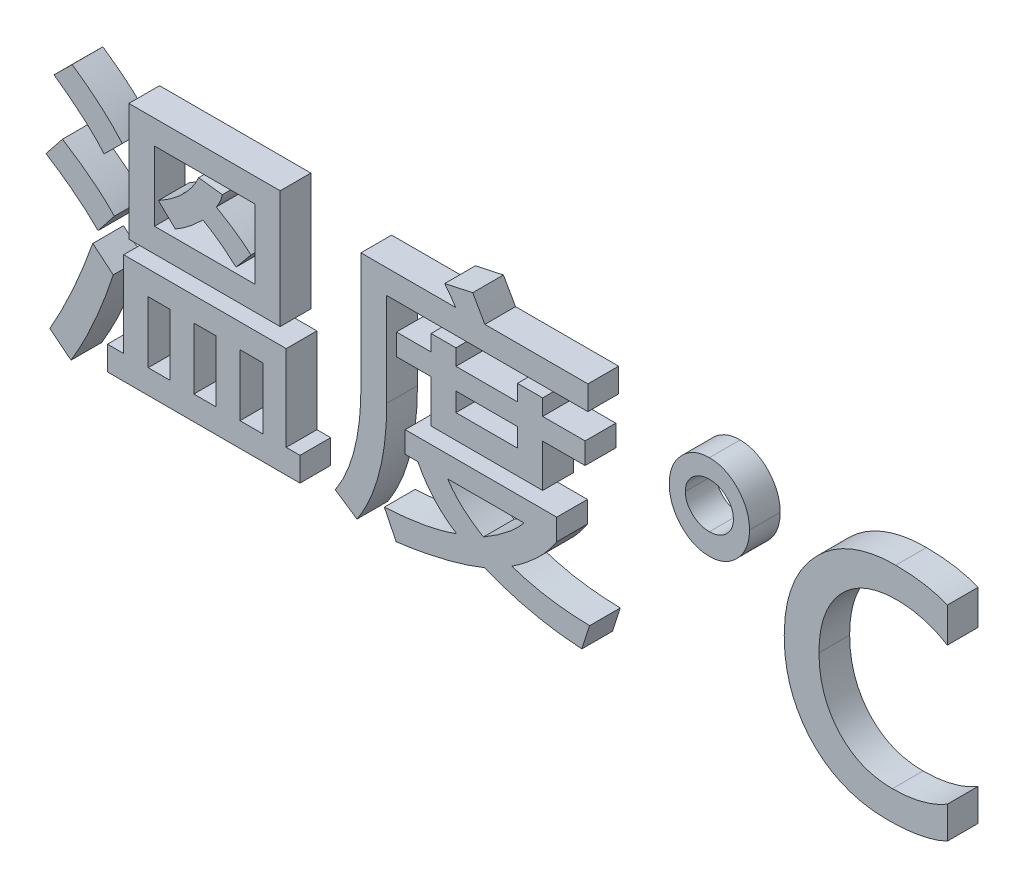
from build123d import *

# Parameters (mm, degrees)
EXTRUDE_1_DEPTH   = 3.5
SKETCH_1_W        = 17.254192073
SKETCH_1_H        = 13.414634147
SKETCH_1_W_2      = 11.43292683
SKETCH_1_H_2      = 7.926829269
EXTRUDE_1_2_DEPTH = 3.5
EXTRUDE_1_3_DEPTH = 3.5
EXTRUDE_1_4_DEPTH = 3.5
SKETCH_1_W_3      = 2.600990854
SKETCH_1_H_3      = 7.012195122
SKETCH_1_W_4      = 2.524771341
SKETCH_1_W_5      = 2.505716463
EXTRUDE_1_5_DEPTH = 3.5
EXTRUDE_1_6_DEPTH = 3.5
EXTRUDE_1_7_DEPTH = 3.5
SKETCH_1_W_6      = 7.012195122
SKETCH_1_H_4      = 2.134146342
EXTRUDE_1_8_DEPTH = 3.5
EXTRUDE_1_9_DEPTH = 3.5
EXTRUDE_2_DEPTH   = 3.5
EXTRUDE_2_2_DEPTH = 3.5


with BuildPart() as part:
    # 草圖1 → 填料-伸長1 (new body)
    with BuildSketch(Plane.XY):
        with BuildLine():
            Line((-55.558712661, 30.843381233), (-57.635694368, 28.785454404))
            add(Edge.make_bspline(
                [(-57.635694368, 28.785454404), (-57.800401407, 28.979405841), (-58.140346552, 29.379709617), (-58.707226202, 29.964119725), (-59.331666853, 30.562892377), (-60.012527692, 31.178815534), (-60.758403849, 31.802001544), (-61.564126763, 32.440019125), (-62.429207191, 33.092119277), (-63.03346811, 33.520531274), (-63.342630344, 33.739722697)],
                knots=[0, 0, 0, 0, 0.80563928, 1.662789676, 2.5768226, 3.545301035, 4.569701786, 5.654296259, 6.799851211, 8, 8, 8, 8], degree=3))
            Line((-63.342630344, 33.739722697), (-61.270412356, 35.797649526))
            add(Edge.make_bspline(
                [(-61.270412356, 35.797649526), (-60.981332808, 35.599898292), (-60.412267838, 35.210616861), (-59.600196193, 34.59556599), (-58.819410619, 33.987584256), (-58.084668757, 33.370087791), (-57.389056307, 32.748650238), (-56.73983428, 32.120449936), (-56.124311117, 31.492933354), (-55.745626313, 31.058039102), (-55.558712661, 30.843381233)],
                knots=[0, 0, 0, 0, 1.10839947, 2.181929898, 3.223550763, 4.240284569, 5.219043447, 6.175191646, 7.099299496, 8, 8, 8, 8], degree=3))
        make_face()
    extrude(amount=EXTRUDE_1_DEPTH)


with BuildPart() as body_2:
    # 草圖1 → Extrude 1 2 (new body)
    with BuildSketch(Plane.XY):
        with Locations((-46.178948942, 28.480576355)):
            Rectangle(SKETCH_1_W, SKETCH_1_H)
        with Locations((-46.164657783, 28.480576356)):
            Rectangle(SKETCH_1_W_2, SKETCH_1_H_2, mode=Mode.SUBTRACT)
    extrude(amount=EXTRUDE_1_2_DEPTH)


with BuildPart() as body_3:
    # 草圖1 → Extrude 1 3 (new body)
    with BuildSketch(Plane.XY):
        with BuildLine():
            Line((-40.881692844, 27.184844648), (-42.587104429, 25.126917819))
            add(Edge.make_bspline(
                [(-42.587104429, 25.126917819), (-42.886141398, 25.392072572), (-43.478048223, 25.916913728), (-44.407057172, 26.644063128), (-45.362003863, 27.306766094), (-46.022667983, 27.702879224), (-46.350442844, 27.899402575)],
                knots=[0, 0, 0, 0, 1.023875124, 2.026634626, 3.020955517, 4, 4, 4, 4], degree=3))
            add(Edge.make_bspline(
                [(-46.350442844, 27.899402575), (-46.620370409, 27.640189006), (-47.139239979, 27.141914466), (-47.943193422, 26.476416207), (-48.720643246, 25.899186155), (-49.256729825, 25.583183249), (-49.5135526, 25.431795868)],
                knots=[0, 0, 0, 0, 1.11587252, 2.144991361, 3.111321783, 4, 4, 4, 4], degree=3))
            Line((-49.5135526, 25.431795868), (-51.442859003, 27.280119038))
            add(Edge.make_bspline(
                [(-51.442859003, 27.280119038), (-51.170845347, 27.435521731), (-50.639486515, 27.739089555), (-49.89432728, 28.241597094), (-49.21447404, 28.768178654), (-48.60889461, 29.330274035), (-48.060170827, 29.908822306), (-47.588626488, 30.524871496), (-47.172380132, 31.159889043), (-46.95398156, 31.610950156), (-46.845869673, 31.834234892)],
                knots=[0, 0, 0, 0, 1.141474461, 2.229787087, 3.272903633, 4.272283632, 5.238641047, 6.175162408, 7.096667017, 8, 8, 8, 8], degree=3))
            Line((-46.845869673, 31.834234892), (-44.14484071, 31.505538246))
            add(Edge.make_bspline(
                [(-44.14484071, 31.505538246), (-44.177102639, 31.374525439), (-44.242676887, 31.108234283), (-44.393799642, 30.715737216), (-44.589031032, 30.322574118), (-44.751986806, 30.071721103), (-44.835580039, 29.943038246)],
                knots=[0, 0, 0, 0, 0.941217816, 1.913080006, 2.929449471, 4, 4, 4, 4], degree=3))
            add(Edge.make_bspline(
                [(-44.835580039, 29.943038246), (-44.439729411, 29.708138377), (-43.682121851, 29.258570021), (-42.627660951, 28.561874327), (-41.696462385, 27.886374621), (-41.144018235, 27.410711123), (-40.881692844, 27.184844648)],
                knots=[0, 0, 0, 0, 1.143743812, 2.188979619, 3.14004587, 4, 4, 4, 4], degree=3))
        make_face()
    extrude(amount=EXTRUDE_1_3_DEPTH)


with BuildPart() as body_4:
    # 草圖1 → Extrude 1 4 (new body)
    with BuildSketch(Plane.XY):
        with BuildLine():
            Line((-56.459055649, 23.221430014), (-58.326433698, 20.858625136))
            add(Edge.make_bspline(
                [(-58.326433698, 20.858625136), (-58.522404588, 21.053294227), (-58.921635802, 21.44987342), (-59.549459623, 22.037985731), (-60.228287017, 22.617044941), (-60.947839754, 23.198468583), (-61.711234875, 23.780840582), (-62.519219319, 24.359195308), (-63.37096237, 24.938413686), (-63.957874669, 25.315605878), (-64.25726449, 25.50801538)],
                knots=[0, 0, 0, 0, 0.877715064, 1.788078067, 2.73268409, 3.712181632, 4.727403113, 5.783191323, 6.86918377, 8, 8, 8, 8], degree=3))
            Line((-64.25726449, 25.50801538), (-62.375595283, 27.870820258))
            add(Edge.make_bspline(
                [(-62.375595283, 27.870820258), (-62.069664681, 27.677122218), (-61.46901202, 27.296822757), (-60.604409144, 26.710651564), (-59.787314225, 26.130701987), (-59.024132743, 25.547933711), (-58.308427615, 24.96736585), (-57.643171216, 24.386985888), (-57.024318814, 23.812365803), (-56.644602089, 23.415403439), (-56.459055649, 23.221430014)],
                knots=[0, 0, 0, 0, 1.15170325, 2.261210932, 3.322199032, 4.338470802, 5.315058025, 6.253002159, 7.14633934, 8, 8, 8, 8], degree=3))
        make_face()
    extrude(amount=EXTRUDE_1_4_DEPTH)


with BuildPart() as body_5:
    # 草圖1 → Extrude 1 5 (new body)
    with BuildSketch(Plane.XY):
        Polygon((-35.289086137, 7.44399099), (-57.249833088, 7.44399099), (-57.249833088, 10.187893429), (-55.401509917, 10.187893429), (-55.401509917, 19.94399099), (-36.861113576, 19.94399099), (-36.861113576, 10.187893429), (-35.289086137, 10.187893429), align=None)
        with Locations((-40.834055649, 13.69399099)):
            Rectangle(SKETCH_1_W_3, SKETCH_1_H_3, mode=Mode.SUBTRACT)
        with Locations((-46.131311747, 13.69399099)):
            Rectangle(SKETCH_1_W_4, SKETCH_1_H_3, mode=Mode.SUBTRACT)
        with Locations((-51.347584613, 13.69399099)):
            Rectangle(SKETCH_1_W_5, SKETCH_1_H_3, mode=Mode.SUBTRACT)
    extrude(amount=EXTRUDE_1_5_DEPTH)


with BuildPart() as body_6:
    # 草圖1 → Extrude 1 6 (new body)
    with BuildSketch(Plane.XY):
        with BuildLine():
            add(Edge.make_bspline(
                [(-56.587676076, 17.362055014), (-56.751881638, 16.865765667), (-57.077517627, 15.881574446), (-57.606425583, 14.432128536), (-58.170573979, 13.023598804), (-58.754585866, 11.64958402), (-59.371378855, 10.314589212), (-60.01073681, 9.013864504), (-60.689793187, 7.755281855), (-61.163599167, 6.9363053), (-61.399032783, 6.529356843)],
                knots=[0, 0, 0, 0, 1.056242446, 2.094634002, 3.117054769, 4.121869083, 5.111029164, 6.088215548, 7.050036625, 8, 8, 8, 8], degree=3))
            Line((-61.399032783, 6.529356843), (-63.823766015, 8.444372087))
            add(Edge.make_bspline(
                [(-63.823766015, 8.444372087), (-63.596473354, 8.84828589), (-63.136837406, 9.665088788), (-62.474020867, 10.921379806), (-61.840824029, 12.223190319), (-61.211357462, 13.55661105), (-60.614372181, 14.936631685), (-60.028144521, 16.354119542), (-59.460290978, 17.811861766), (-59.102455596, 18.801524021), (-58.921898637, 19.300888855)],
                knots=[0, 0, 0, 0, 0.932552104, 1.885826268, 2.857492246, 3.845184593, 4.852505817, 5.882555274, 6.931577484, 8, 8, 8, 8], degree=3))
            Line((-58.921898637, 19.300888855), (-56.587676076, 17.362055014))
        make_face()
    extrude(amount=EXTRUDE_1_6_DEPTH)


with BuildPart() as body_7:
    # 草圖1 → Extrude 1 7 (new body)
    with BuildSketch(Plane.XY):
        with BuildLine():
            Line((-2.457531259, 30.919600746), (-25.399604429, 30.919600746))
            Line((-25.399604429, 30.919600746), (-25.399604429, 20.267923916))
            add(Edge.make_bspline(
                [(-25.399604429, 20.267923916), (-25.409371988, 19.618159484), (-25.428507046, 18.345243518), (-25.586875948, 16.48015672), (-25.852760876, 14.702757044), (-26.222169664, 13.013130174), (-26.698896056, 11.410771016), (-27.279624891, 9.896155485), (-27.967373389, 8.46668903), (-28.518210157, 7.579215347), (-28.791372722, 7.139112941)],
                knots=[0, 0, 0, 0, 1.13379834, 2.221158835, 3.263630851, 4.268138338, 5.236941435, 6.178197068, 7.096559291, 8, 8, 8, 8], degree=3))
            Line((-28.791372722, 7.139112941), (-31.268506868, 8.796887331))
            add(Edge.make_bspline(
                [(-31.268506868, 8.796887331), (-31.032661934, 9.175511388), (-30.555223573, 9.941988096), (-29.963331443, 11.183936911), (-29.465713884, 12.508481561), (-29.047359622, 13.914604376), (-28.733478544, 15.408038624), (-28.504029779, 16.986133497), (-28.37226113, 18.649183657), (-28.353283876, 19.786558852), (-28.343583088, 20.367962026)],
                knots=[0, 0, 0, 0, 0.883888601, 1.789321126, 2.72197617, 3.687277845, 4.695045742, 5.744945383, 6.847261732, 8, 8, 8, 8], degree=3))
            Line((-28.343583088, 20.367962026), (-28.343583088, 33.663503185))
            Line((-28.343583088, 33.663503185), (-17.539467234, 33.663503185))
            add(Edge.make_bspline(
                [(-17.539467234, 33.663503185), (-17.74521127, 33.981839215), (-18.134187437, 34.583679889), (-18.581576978, 35.143373696), (-18.792325466, 35.407024526)],
                knots=[0, 0, 0, 0, 1.057874767, 2, 2, 2, 2], degree=3))
            Line((-18.792325466, 35.407024526), (-15.591105954, 36.102527575))
            add(Edge.make_bspline(
                [(-15.591105954, 36.102527575), (-15.367809832, 35.715638988), (-14.900729689, 34.906363954), (-14.446634208, 34.08973032), (-14.209627295, 33.663503185)],
                knots=[0, 0, 0, 0, 0.956136221, 2, 2, 2, 2], degree=3))
            Line((-14.209627295, 33.663503185), (-2.457531259, 33.663503185))
            Line((-2.457531259, 33.663503185), (-2.457531259, 30.919600746))
        make_face()
    extrude(amount=EXTRUDE_1_7_DEPTH)


with BuildPart() as body_8:
    # 草圖1 → Extrude 1 8 (new body)
    with BuildSketch(Plane.XY):
        Polygon((-2.776700466, 25.431795868), (-7.61663949, 25.431795868), (-7.61663949, 20.553747087), (-20.335770588, 20.553747087), (-20.335770588, 25.431795868), (-24.289657783, 25.431795868), (-24.289657783, 27.870820258), (-20.335770588, 27.870820258), (-20.335770588, 29.700088551), (-17.506121198, 29.700088551), (-17.506121198, 27.870820258), (-10.493926076, 27.870820258), (-10.493926076, 29.700088551), (-7.61663949, 29.700088551), (-7.61663949, 27.870820258), (-2.776700466, 27.870820258), align=None)
        with Locations((-14.000023637, 24.364722697)):
            Rectangle(SKETCH_1_W_6, SKETCH_1_H_4, mode=Mode.SUBTRACT)
    extrude(amount=EXTRUDE_1_8_DEPTH)


with BuildPart() as body_9:
    # 草圖1 → Extrude 1 9 (new body)
    with BuildSketch(Plane.XY):
        with BuildLine():
            Line((-2.262218759, 9.88301538), (-3.148270588, 7.139112941))
            add(Edge.make_bspline(
                [(-3.148270588, 7.139112941), (-3.636090584, 7.173477064), (-4.607101783, 7.241879239), (-6.050126155, 7.410382814), (-7.473377889, 7.631694093), (-8.871540974, 7.922332758), (-10.251886796, 8.250712066), (-11.604979596, 8.649194173), (-12.936982915, 9.100424313), (-13.807647369, 9.444307812), (-14.242973332, 9.616247087)],
                knots=[0, 0, 0, 0, 1.027575639, 2.045400889, 3.052110208, 4.053401572, 5.045672083, 6.033015074, 7.01652169, 8, 8, 8, 8], degree=3))
            add(Edge.make_bspline(
                [(-14.242973332, 9.616247087), (-14.605487198, 9.473497288), (-15.339498833, 9.18446003), (-16.480148143, 8.800097081), (-17.666838781, 8.443631053), (-18.905128695, 8.120337593), (-20.188441425, 7.824955848), (-21.523372323, 7.563978937), (-22.904944836, 7.329026465), (-23.8462099, 7.202967558), (-24.32300382, 7.139112941)],
                knots=[0, 0, 0, 0, 0.898245895, 1.818752324, 2.774414431, 3.754865284, 4.769181396, 5.810381228, 6.890857679, 8, 8, 8, 8], degree=3))
            Line((-24.32300382, 7.139112941), (-25.671136442, 9.88301538))
            add(Edge.make_bspline(
                [(-25.671136442, 9.88301538), (-25.261242882, 9.907192959), (-24.459514693, 9.954482912), (-23.287387264, 10.071243274), (-22.171921606, 10.212448729), (-21.113744691, 10.383920442), (-20.111562666, 10.581238564), (-19.168183827, 10.816191303), (-18.279690115, 11.074232378), (-17.714748557, 11.279021218), (-17.439429125, 11.378823307)],
                knots=[0, 0, 0, 0, 1.173258055, 2.294825167, 3.365331127, 4.385853445, 5.35763591, 6.283198638, 7.163331551, 8, 8, 8, 8], degree=3))
            add(Edge.make_bspline(
                [(-17.439429125, 11.378823307), (-17.673548901, 11.53278503), (-18.138381696, 11.838468127), (-18.7930498, 12.352882495), (-19.407519088, 12.904900349), (-19.982269705, 13.497212901), (-20.511995784, 14.134112955), (-21.001851848, 14.810533077), (-21.45436063, 15.52646889), (-21.714571799, 16.030918305), (-21.845869673, 16.285454404)],
                knots=[0, 0, 0, 0, 1.006386301, 1.998128322, 2.987882766, 3.972344942, 4.960667833, 5.961475848, 6.97139739, 8, 8, 8, 8], degree=3))
            Line((-21.845869673, 16.285454404), (-23.294040405, 16.285454404))
            Line((-23.294040405, 16.285454404), (-23.294040405, 18.724478794))
            Line((-23.294040405, 18.724478794), (-6.011266015, 18.724478794))
            Line((-6.011266015, 18.724478794), (-6.011266015, 16.285454404))
            add(Edge.make_bspline(
                [(-6.011266015, 16.285454404), (-6.159204575, 16.061084467), (-6.458605751, 15.606999858), (-6.96793491, 14.955525591), (-7.525492553, 14.314048119), (-8.143341707, 13.693019595), (-8.806834811, 13.075255194), (-9.525063371, 12.470082412), (-10.3037611, 11.886303367), (-10.846731507, 11.511951277), (-11.122737051, 11.321658673)],
                knots=[0, 0, 0, 0, 0.898501417, 1.818406109, 2.763116231, 3.739492504, 4.7465817, 5.794405407, 6.87884067, 8, 8, 8, 8], degree=3))
            add(Edge.make_bspline(
                [(-11.122737051, 11.321658673), (-10.804580183, 11.213613816), (-10.15878628, 10.994304676), (-9.156111433, 10.721325535), (-8.112002514, 10.482665054), (-7.024695101, 10.283950295), (-5.895167078, 10.120212034), (-4.72174658, 10.006070935), (-3.50681624, 9.915120511), (-2.681592811, 9.893833383), (-2.262218759, 9.88301538)],
                knots=[0, 0, 0, 0, 0.894362528, 1.815374505, 2.76501896, 3.745105138, 4.757279056, 5.802599343, 6.883292952, 8, 8, 8, 8], degree=3))
        make_face()
        with BuildLine():
            Line((-9.741258393, 16.285454404), (-18.454101381, 16.285454404))
            add(Edge.make_bspline(
                [(-18.454101381, 16.285454404), (-18.337398566, 16.113805548), (-18.101296866, 15.766542401), (-17.697981867, 15.271438707), (-17.252223836, 14.7898872), (-16.768157997, 14.315944872), (-16.230238454, 13.865238037), (-15.65289465, 13.422518152), (-15.035400713, 12.985337184), (-14.595647034, 12.719491818), (-14.371593759, 12.584044343)],
                knots=[0, 0, 0, 0, 0.895916304, 1.812530079, 2.753889512, 3.728495845, 4.735461845, 5.781830076, 6.869848597, 8, 8, 8, 8], degree=3))
            add(Edge.make_bspline(
                [(-14.371593759, 12.584044343), (-14.11805607, 12.734751312), (-13.621821549, 13.029721266), (-12.914260253, 13.489994768), (-12.259620461, 13.954602377), (-11.653621861, 14.414351529), (-11.100371799, 14.878582499), (-10.592683434, 15.337274201), (-10.143264624, 15.806061904), (-9.872974496, 16.128382929), (-9.741258393, 16.285454404)],
                knots=[0, 0, 0, 0, 1.187785328, 2.324782908, 3.398283713, 4.420259799, 5.387274096, 6.3061455, 7.174561368, 8, 8, 8, 8], degree=3))
        make_face(mode=Mode.SUBTRACT)
    extrude(amount=EXTRUDE_1_9_DEPTH)


with BuildPart() as body_10:
    # 草圖2 → 填料-伸長2 (new body)
    with BuildSketch(Plane.XY.offset(3.5)):
        with BuildLine():
            add(Edge.make_bspline(
                [(11.395309267, 33.301982297), (11.549598941, 33.297279061), (11.85328423, 33.288021776), (12.299992193, 33.218376604), (12.730597451, 33.110907111), (13.144513071, 32.951704537), (13.53894354, 32.743639197), (13.923875496, 32.501970601), (14.287214826, 32.2084601), (14.625310776, 31.87202514), (14.938146438, 31.507690208), (15.215911125, 31.123977177), (15.445492258, 30.718354528), (15.637966803, 30.298497983), (15.786549823, 29.857782758), (15.888349061, 29.399240584), (15.960742059, 28.924818566), (15.965874629, 28.602061169), (15.968479998, 28.438224675)],
                knots=[0, 0, 0, 0, 0.998631793, 1.965587034, 2.920662495, 3.867735322, 4.828824026, 5.80426913, 6.806229794, 7.845884469, 8.888585014, 9.91287449, 10.907581954, 11.901438878, 12.899594212, 13.912206795, 14.940204864, 16, 16, 16, 16], degree=3))
            add(Edge.make_bspline(
                [(15.968479998, 28.438224675), (15.965875858, 28.274387431), (15.960745709, 27.951628556), (15.888335058, 27.477217313), (15.786601201, 27.018635233), (15.637778275, 26.578066437), (15.445292817, 26.155691507), (15.210344486, 25.749258679), (14.933745477, 25.357894554), (14.617177339, 24.990176518), (14.271831725, 24.655036169), (13.910438374, 24.357118593), (13.529998557, 24.10723161), (13.134856295, 23.900824636), (12.721678353, 23.74401454), (12.294642178, 23.627226471), (11.849953326, 23.560641893), (11.547959464, 23.550839564), (11.395309267, 23.545884736)],
                knots=[0, 0, 0, 0, 1.057806249, 2.083875102, 3.094587344, 4.090869469, 5.082861249, 6.089710816, 7.120439105, 8.175653664, 9.220689148, 10.227224875, 11.197805977, 12.157091033, 13.102386515, 14.048350208, 15.013490791, 16, 16, 16, 16], degree=3))
            add(Edge.make_bspline(
                [(11.395309267, 23.545884736), (11.241054802, 23.550779359), (10.935868181, 23.560463186), (10.485199229, 23.628157087), (10.052415008, 23.741901997), (9.63799198, 23.901890242), (9.239520239, 24.102763468), (8.857232178, 24.35129783), (8.495348602, 24.649012694), (8.15419292, 24.985537247), (7.844127823, 25.352805737), (7.568880042, 25.740316038), (7.340588877, 26.148724517), (7.147499583, 26.571063254), (7.005439242, 27.014857625), (6.901344143, 27.473828543), (6.83029089, 27.950127272), (6.824874588, 28.274411819), (6.822138535, 28.438224675)],
                knots=[0, 0, 0, 0, 0.995075562, 1.968719331, 2.932884519, 3.87658472, 4.829581595, 5.807098437, 6.811935535, 7.847887892, 8.89467502, 9.909386627, 10.909459824, 11.909113131, 12.900490104, 13.909496668, 14.943978905, 16, 16, 16, 16], degree=3))
            add(Edge.make_bspline(
                [(6.822138535, 28.438224675), (6.824743905, 28.602061169), (6.829876475, 28.924818566), (6.902269472, 29.399240584), (7.00406871, 29.857782758), (7.152651731, 30.298497983), (7.345126276, 30.718354528), (7.574707409, 31.123977177), (7.852472096, 31.507690208), (8.165307757, 31.87202514), (8.503403708, 32.2084601), (8.866743038, 32.501970601), (9.251674994, 32.743639197), (9.646105462, 32.951704537), (10.060021082, 33.110907111), (10.490626341, 33.218376604), (10.937334304, 33.288021776), (11.241019592, 33.297279061), (11.395309267, 33.301982297)],
                knots=[0, 0, 0, 0, 1.059795136, 2.087793205, 3.100405788, 4.098561122, 5.092418046, 6.08712551, 7.111414986, 8.154115531, 9.193770206, 10.19573087, 11.171175974, 12.132264678, 13.079337505, 14.034412966, 15.001368207, 16, 16, 16, 16], degree=3))
        make_face()
        with BuildLine():
            add(Edge.make_bspline(
                [(11.395309267, 25.984909126), (11.579131477, 25.992876622), (11.938823332, 26.00846692), (12.452994126, 26.166790563), (12.930097913, 26.403770326), (13.343620518, 26.746367001), (13.694169215, 27.142986059), (13.955573769, 27.58962952), (14.107795227, 28.077659982), (14.1286456, 28.414966834), (14.139211706, 28.58589998)],
                knots=[0, 0, 0, 0, 1.049286664, 2.05317881, 3.053236381, 4.081041818, 5.105465247, 6.070582986, 7.022251352, 8, 8, 8, 8], degree=3))
            add(Edge.make_bspline(
                [(14.139211706, 28.58589998), (14.128817795, 28.75846898), (14.108399924, 29.09746471), (13.955166263, 29.586596482), (13.696942496, 30.032821696), (13.341484204, 30.420810452), (12.930023462, 30.758921588), (12.452569533, 30.991129084), (11.938090926, 31.14306753), (11.579032615, 31.15945222), (11.395309267, 31.167835956)],
                knots=[0, 0, 0, 0, 0.98887956, 1.942561802, 2.909721877, 3.922643092, 4.94692818, 5.944995164, 6.948492885, 8, 8, 8, 8], degree=3))
            add(Edge.make_bspline(
                [(11.395309267, 31.167835956), (11.211608901, 31.159425366), (10.852595505, 31.142988195), (10.33779239, 30.991428923), (9.860439207, 30.757238191), (9.444370402, 30.424120117), (9.094180547, 30.030920488), (8.835185253, 29.586849743), (8.682287839, 29.097399047), (8.661824092, 28.75844683), (8.651406828, 28.58589998)],
                knots=[0, 0, 0, 0, 1.05136184, 2.054720919, 3.05265001, 4.083937029, 5.090680128, 6.057706581, 7.011257063, 8, 8, 8, 8], degree=3))
            add(Edge.make_bspline(
                [(8.651406828, 28.58589998), (8.661996135, 28.414988348), (8.682892294, 28.077723948), (8.83477581, 27.589380142), (9.096970305, 27.144861956), (9.442169835, 26.743053533), (9.860388689, 26.405456034), (10.337365124, 26.166492366), (10.851863561, 26.008545539), (11.211510176, 25.992903211), (11.395309267, 25.984909126)],
                knots=[0, 0, 0, 0, 0.977608769, 1.929140988, 2.894120656, 3.912452844, 4.94720042, 5.947114921, 6.950863448, 8, 8, 8, 8], degree=3))
        make_face(mode=Mode.SUBTRACT)
    extrude(amount=-EXTRUDE_2_DEPTH)


with BuildPart() as body_11:
    # 草圖2 → Extrude 2 2 (new body)
    with BuildSketch(Plane.XY.offset(3.5)):
        with BuildLine():
            add(Edge.make_bspline(
                [(38.529455608, 8.987957907), (38.295866729, 8.882839535), (37.822653211, 8.669886612), (37.071322837, 8.409668663), (36.279279931, 8.186396373), (35.440403229, 8.006609367), (34.561342793, 7.86334486), (33.635690024, 7.765704658), (32.667824507, 7.701363535), (32.006443786, 7.695308925), (31.669699511, 7.692226199)],
                knots=[0, 0, 0, 0, 0.873229781, 1.769023159, 2.708553228, 3.678358573, 4.693321154, 5.744689587, 6.851700922, 8, 8, 8, 8], degree=3))
            add(Edge.make_bspline(
                [(31.669699511, 7.692226199), (31.237322423, 7.70200293), (30.390243877, 7.721156718), (29.153431722, 7.879416098), (27.982415514, 8.146637715), (26.878333104, 8.519388308), (25.835721799, 8.990799126), (24.862031692, 9.57771441), (23.955525816, 10.270358099), (23.121290843, 11.063232862), (22.370442029, 11.939975974), (21.719928901, 12.895971357), (21.164504998, 13.914813367), (20.708247938, 15.002606557), (20.364579989, 16.161872409), (20.110213073, 17.385125214), (19.963072805, 18.676952378), (19.942441221, 19.559869501), (19.931894633, 20.011204858)],
                knots=[0, 0, 0, 0, 1.081812089, 2.119399567, 3.114266169, 4.083181305, 5.031045332, 5.972246394, 6.922066112, 7.880624707, 8.847451274, 9.80531765, 10.769166742, 11.747078106, 12.751589147, 13.790507572, 14.870537192, 16, 16, 16, 16], degree=3))
            add(Edge.make_bspline(
                [(19.931894633, 20.011204858), (19.94274846, 20.483335749), (19.964051027, 21.409976527), (20.13507452, 22.766361493), (20.407642143, 24.061108387), (20.80312783, 25.288894569), (21.294571994, 26.460616397), (21.91762334, 27.558141346), (22.636876884, 28.600159196), (23.471514701, 29.560171148), (24.382963718, 30.440822865), (25.374592367, 31.208362358), (26.43386481, 31.853355249), (27.553606545, 32.386415832), (28.73829102, 32.79591076), (29.984139414, 33.091759964), (31.296023571, 33.271896785), (32.193129683, 33.291815496), (32.65102573, 33.301982297)],
                knots=[0, 0, 0, 0, 1.098062339, 2.155142483, 3.175320911, 4.1718764, 5.151715059, 6.125889682, 7.102505752, 8.09261102, 9.080232189, 10.046727831, 11.003409711, 11.960170045, 12.926354998, 13.913768876, 14.9351572, 16, 16, 16, 16], degree=3))
            add(Edge.make_bspline(
                [(32.65102573, 33.301982297), (32.940107614, 33.299884505), (33.504397421, 33.2957896), (34.332148855, 33.244995214), (35.124095609, 33.171858351), (35.878836701, 33.061404772), (36.596890435, 32.925879338), (37.274739813, 32.751363516), (37.919924694, 32.556638246), (38.328861139, 32.391924982), (38.529455608, 32.311128638)],
                knots=[0, 0, 0, 0, 1.156157513, 2.256827338, 3.316087736, 4.33651165, 5.306901744, 6.237369836, 7.135381876, 8, 8, 8, 8], degree=3))
            Line((38.529455608, 32.311128638), (38.529455608, 28.347714004))
            add(Edge.make_bspline(
                [(38.529455608, 28.347714004), (38.312239286, 28.476696831), (37.879952029, 28.733388556), (37.199017636, 29.054600236), (36.504691915, 29.332994527), (35.790630924, 29.556220806), (35.060756704, 29.734894468), (34.311909632, 29.85545248), (33.546799506, 29.936434555), (33.030748079, 29.944334121), (32.770118718, 29.94832376)],
                knots=[0, 0, 0, 0, 1.000698145, 1.991512659, 2.980166353, 3.963397223, 4.954011858, 5.955501226, 6.967435452, 8, 8, 8, 8], degree=3))
            add(Edge.make_bspline(
                [(32.770118718, 29.94832376), (32.4426404, 29.939997627), (31.802725168, 29.923727789), (30.868566113, 29.799404571), (29.985524034, 29.587023546), (29.146588293, 29.300690515), (28.364031365, 28.91410629), (27.626926152, 28.454833981), (26.942242249, 27.907074492), (26.312419456, 27.278997432), (25.741925705, 26.587896932), (25.249148134, 25.837029907), (24.825731539, 25.039972334), (24.48975667, 24.184975595), (24.220977521, 23.281712494), (24.032831032, 22.324765963), (23.916047045, 21.317781441), (23.902314614, 20.629226689), (23.895309267, 20.277973151)],
                knots=[0, 0, 0, 0, 1.063652607, 2.078450591, 3.054364451, 4.010361573, 4.95163226, 5.883370162, 6.826744596, 7.793357237, 8.768234429, 9.732531893, 10.706275672, 11.694827412, 12.711668615, 13.763788352, 14.859237769, 16, 16, 16, 16], degree=3))
            add(Edge.make_bspline(
                [(23.895309267, 20.277973151), (23.900438809, 19.942557827), (23.910483971, 19.285715429), (24.026528054, 18.325986243), (24.195964147, 17.412299901), (24.454332334, 16.550355492), (24.768243017, 15.73367962), (25.16524276, 14.96974381), (25.626191081, 14.252530144), (26.160920873, 13.591242369), (26.750620999, 12.992664318), (27.39822632, 12.473234597), (28.088140861, 12.025959895), (28.834568652, 11.670099522), (29.624593216, 11.382974775), (30.467364605, 11.196172212), (31.35425133, 11.062925509), (31.962927611, 11.051656651), (32.274691889, 11.045884736)],
                knots=[0, 0, 0, 0, 1.14570342, 2.243626122, 3.299431414, 4.317736089, 5.314423708, 6.285290861, 7.254700848, 8.223442235, 9.18663467, 10.120627236, 11.055470792, 11.989936226, 12.940896808, 13.921603267, 14.935444215, 16, 16, 16, 16], degree=3))
            add(Edge.make_bspline(
                [(32.274691889, 11.045884736), (32.567058825, 11.049823736), (33.143294523, 11.057587242), (33.994084307, 11.138197304), (34.81905697, 11.258453006), (35.61572678, 11.436786128), (36.38710559, 11.659518537), (37.12929219, 11.937794318), (37.848793813, 12.258326575), (38.302773931, 12.517222429), (38.529455608, 12.646494492)],
                knots=[0, 0, 0, 0, 1.073382705, 2.115565596, 3.135735895, 4.133203503, 5.111254161, 6.081800706, 7.04220336, 8, 8, 8, 8], degree=3))
            Line((38.529455608, 12.646494492), (38.529455608, 8.987957907))
        make_face()
    extrude(amount=-EXTRUDE_2_2_DEPTH)


solid = Compound([part.part, body_2.part, body_3.part, body_4.part, body_5.part, body_6.part, body_7.part, body_8.part, body_9.part, body_10.part, body_11.part])
